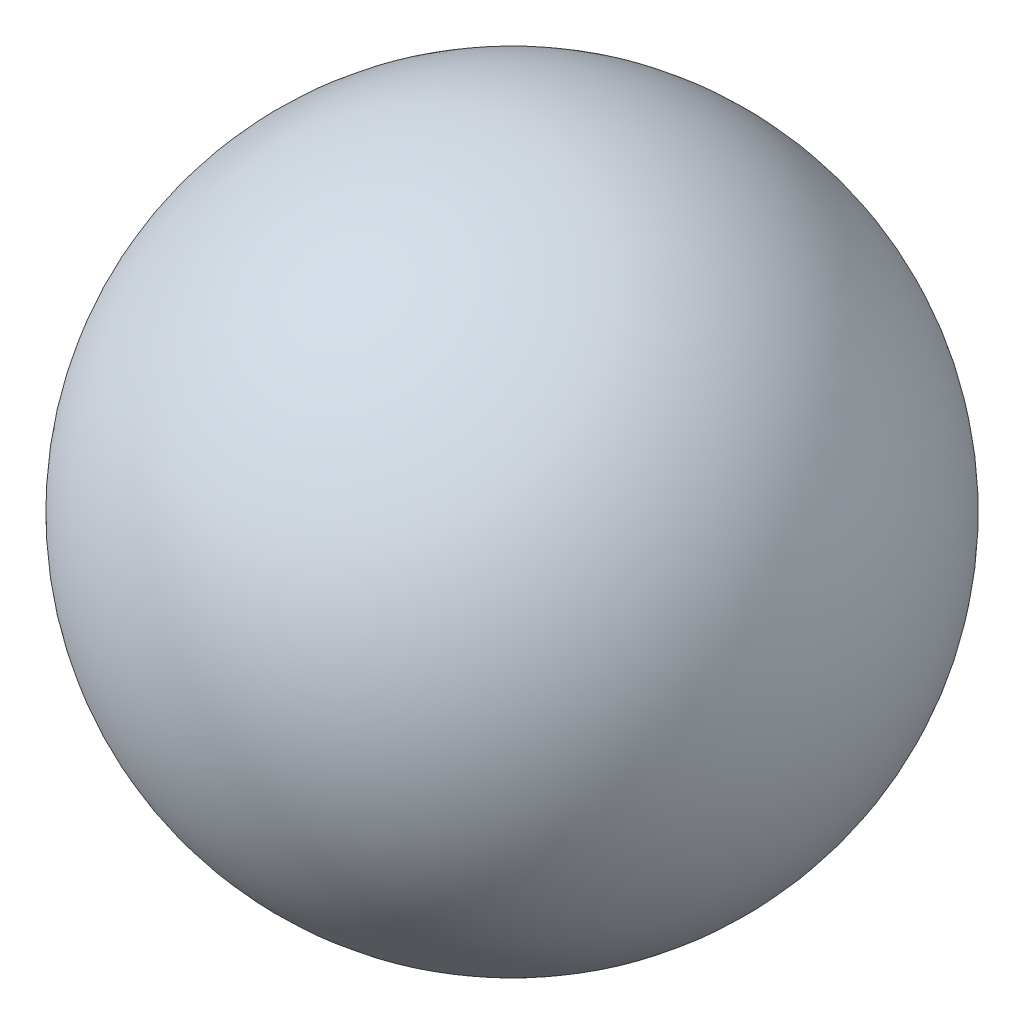
from build123d import *


with BuildPart() as part:
    # Sketch1 → Revolve1 (revolve)
    with BuildSketch(Plane.XY):
        with BuildLine():
            Line((0, 2.35839), (0, 0))
            ThreePointArc((0, 0), (-1.179195, 1.179195), (0, 2.35839))
        make_face()
    revolve(axis=Axis((0, 2.35839, 0), (0, -1, 0)))


solid = part.part
